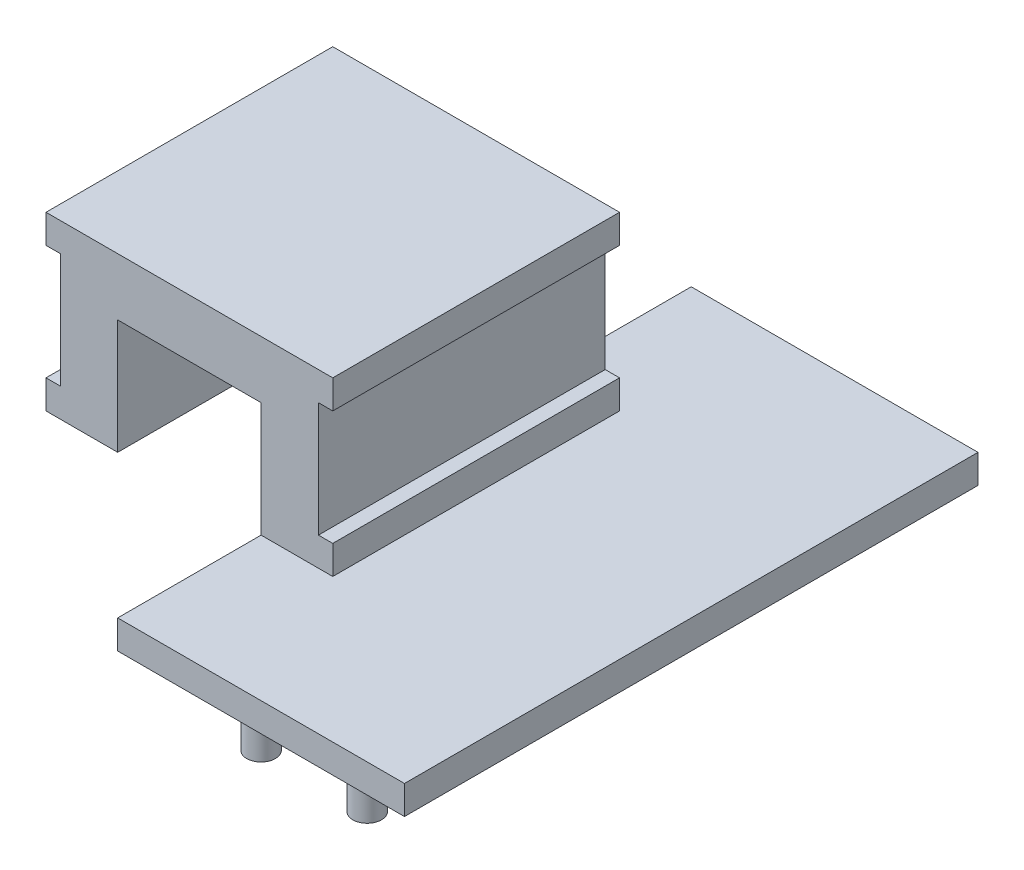
from build123d import *

# Parameters (mm, degrees)
SKETCH1_W           = 25.4
SKETCH1_H           = 25.4
BOSS_EXTRUDE1_DEPTH = 15.24
SKETCH2_W           = 12.7
SKETCH2_H           = 25.4
CUT_EXTRUDE1_DEPTH  = 10.16
SKETCH3_W           = 1.27
SKETCH3_H           = 10.16
CUT_EXTRUDE2_DEPTH  = 33.228986953
SKETCH4_W           = 25.4
SKETCH4_H           = 50.8
BOSS_EXTRUDE2_DEPTH = 2.54
SKETCH5_R           = 1.27
BOSS_EXTRUDE3_DEPTH = 7.62


with BuildPart() as part:
    # Sketch1 → Boss-Extrude1 (new body)
    with BuildSketch(Plane(origin=(0, 0, 0), x_dir=(1, 0, 0), z_dir=(0, 1, 0))):
        Rectangle(SKETCH1_W, SKETCH1_H)
    extrude(amount=BOSS_EXTRUDE1_DEPTH)

    # Sketch2 → Cut-Extrude1 (cut)
    with BuildSketch(Plane.XZ):
        Rectangle(SKETCH2_W, SKETCH2_H)
    extrude(amount=-CUT_EXTRUDE1_DEPTH, mode=Mode.SUBTRACT)

    # Sketch3 → Cut-Extrude2 (cut, through all)
    with BuildSketch(Plane.XY.offset(12.7)):
        with Locations((-12.065, 7.62)):
            Rectangle(SKETCH3_W, SKETCH3_H)
        with Locations((12.065, 7.62)):
            Rectangle(SKETCH3_W, SKETCH3_H)
    extrude(amount=-CUT_EXTRUDE2_DEPTH, mode=Mode.SUBTRACT)

    # Sketch4 → Boss-Extrude2 (add)
    with BuildSketch(Plane.XZ):
        with Locations((19.05, 0)):
            Rectangle(SKETCH4_W, SKETCH4_H)
    extrude(amount=BOSS_EXTRUDE2_DEPTH)

    # Sketch5 → Boss-Extrude3 (add)
    with BuildSketch(Plane.XZ.offset(2.54)):
        with Locations(Location((12.7, 19.05, 0), (0, 0, 90))):
            Circle(SKETCH5_R)
        with Locations(Location((22.098, 19.05, 0), (0, 0, 90))):
            Circle(SKETCH5_R)
        with Locations(Location((12.7, -19.05, 0), (0, 0, 90))):
            Circle(SKETCH5_R)
        with Locations(Location((22.098, -19.05, 0), (0, 0, 90))):
            Circle(SKETCH5_R)
    extrude(amount=BOSS_EXTRUDE3_DEPTH)


solid = part.part
